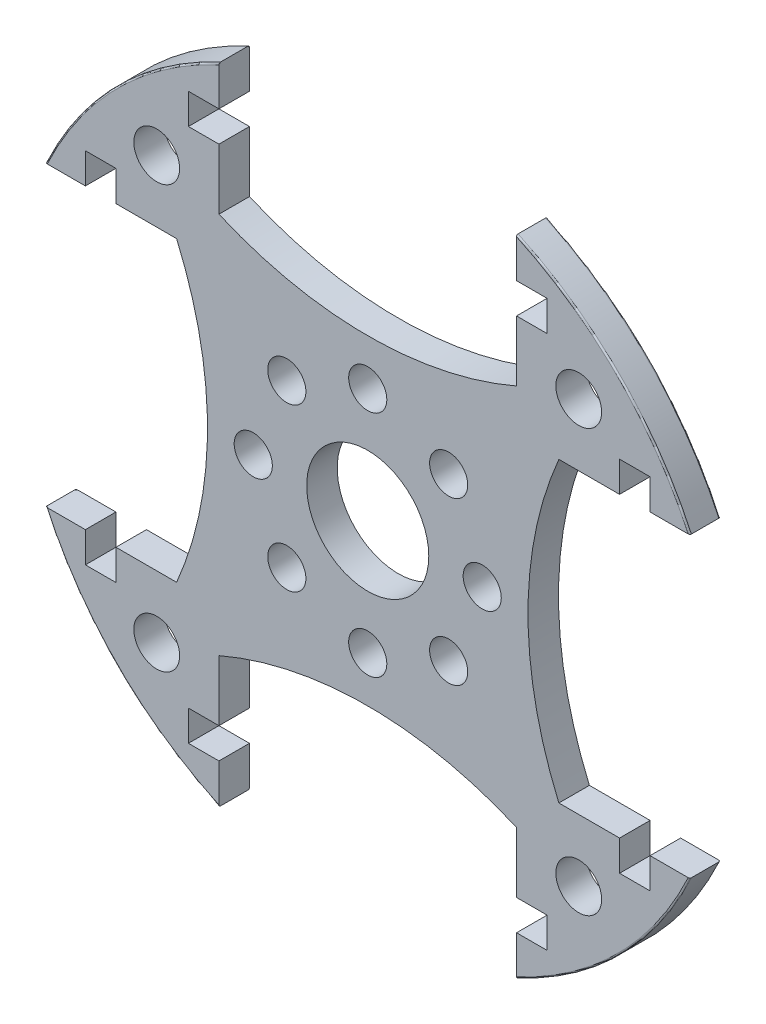
from build123d import *

# Parameters (mm, degrees)
SKETCH_2_R      = 4
SKETCH_2_R_2    = 1.25
SKETCH_2_R_3    = 1.5
EXTRUDE_1_DEPTH = 2
FILLET_1_R      = 0.1


with BuildPart() as part:
    # Эскиз2 → Бобышка-Вытянуть1 (new body)
    with BuildSketch(Plane.XY):
        with BuildLine():
            Line((-9.75, 16.5), (-9.75, 12.523623513))
            ThreePointArc((-9.75, 12.523623513), (0, 10.5), (9.75, 12.523623513))
            Line((9.75, 12.523623513), (9.75, 16.5))
            Line((9.75, 16.5), (11.75, 16.5))
            Line((11.75, 16.5), (11.75, 18.5))
            Line((11.75, 18.5), (9.75, 18.5))
            Line((9.75, 18.5), (9.75, 21.106870919))
            ThreePointArc((9.75, 21.106870919), (16.440232663, 16.440232663), (21.106870919, 9.75))
            Line((21.106870919, 9.75), (18.5, 9.75))
            Line((18.5, 9.75), (18.5, 11.75))
            Line((18.5, 11.75), (16.5, 11.75))
            Line((16.5, 11.75), (16.5, 9.75))
            Line((16.5, 9.75), (12.523623513, 9.75))
            ThreePointArc((12.523623513, 9.75), (10.5, 0), (12.523623513, -9.75))
            Line((12.523623513, -9.75), (16.5, -9.75))
            Line((16.5, -9.75), (16.5, -11.75))
            Line((16.5, -11.75), (18.5, -11.75))
            Line((18.5, -11.75), (18.5, -9.75))
            Line((18.5, -9.75), (21.106870919, -9.75))
            ThreePointArc((21.106870919, -9.75), (16.440232663, -16.440232663), (9.75, -21.106870919))
            Line((9.75, -21.106870919), (9.75, -18.5))
            Line((9.75, -18.5), (11.75, -18.5))
            Line((11.75, -18.5), (11.75, -16.5))
            Line((11.75, -16.5), (9.75, -16.5))
            Line((9.75, -16.5), (9.75, -12.523623513))
            ThreePointArc((9.75, -12.523623513), (0, -10.5), (-9.75, -12.523623513))
            Line((-9.75, -12.523623513), (-9.75, -16.5))
            Line((-9.75, -16.5), (-11.75, -16.5))
            Line((-11.75, -16.5), (-11.75, -18.5))
            Line((-11.75, -18.5), (-9.75, -18.5))
            Line((-9.75, -18.5), (-9.75, -21.106870919))
            ThreePointArc((-9.75, -21.106870919), (-16.440232663, -16.440232663), (-21.106870919, -9.75))
            Line((-21.106870919, -9.75), (-18.5, -9.75))
            Line((-18.5, -9.75), (-18.5, -11.75))
            Line((-18.5, -11.75), (-16.5, -11.75))
            Line((-16.5, -11.75), (-16.5, -9.75))
            Line((-16.5, -9.75), (-12.523623513, -9.75))
            ThreePointArc((-12.523623513, -9.75), (-10.5, 0), (-12.523623513, 9.75))
            Line((-12.523623513, 9.75), (-16.5, 9.75))
            Line((-16.5, 9.75), (-16.5, 11.75))
            Line((-16.5, 11.75), (-18.5, 11.75))
            Line((-18.5, 11.75), (-18.5, 9.75))
            Line((-18.5, 9.75), (-21.106870919, 9.75))
            ThreePointArc((-21.106870919, 9.75), (-16.440232663, 16.440232663), (-9.75, 21.106870919))
            Line((-9.75, 21.106870919), (-9.75, 18.5))
            Line((-9.75, 18.5), (-11.75, 18.5))
            Line((-11.75, 18.5), (-11.75, 16.5))
            Line((-11.75, 16.5), (-9.75, 16.5))
        make_face()
        Circle(SKETCH_2_R, mode=Mode.SUBTRACT)
        with Locations((0, 7.5)):
            Circle(SKETCH_2_R_2, mode=Mode.SUBTRACT)
        with Locations((5.303300859, 5.303300859)):
            Circle(SKETCH_2_R_2, mode=Mode.SUBTRACT)
        with Locations((7.5, 0)):
            Circle(SKETCH_2_R_2, mode=Mode.SUBTRACT)
        with Locations((5.303300859, -5.303300859)):
            Circle(SKETCH_2_R_2, mode=Mode.SUBTRACT)
        with Locations((0, -7.5)):
            Circle(SKETCH_2_R_2, mode=Mode.SUBTRACT)
        with Locations((-5.303300859, -5.303300859)):
            Circle(SKETCH_2_R_2, mode=Mode.SUBTRACT)
        with Locations((-7.5, 0)):
            Circle(SKETCH_2_R_2, mode=Mode.SUBTRACT)
        with Locations((-5.303300859, 5.303300859)):
            Circle(SKETCH_2_R_2, mode=Mode.SUBTRACT)
        with Locations((13.825687912, 13.825687912)):
            Circle(SKETCH_2_R_3, mode=Mode.SUBTRACT)
        with Locations((13.825687912, -13.825687912)):
            Circle(SKETCH_2_R_3, mode=Mode.SUBTRACT)
        with Locations((-13.825687912, -13.825687912)):
            Circle(SKETCH_2_R_3, mode=Mode.SUBTRACT)
        with Locations((-13.825687912, 13.825687912)):
            Circle(SKETCH_2_R_3, mode=Mode.SUBTRACT)
    extrude(amount=EXTRUDE_1_DEPTH)

    # Скругление1
    fillet_1_edges = [part.edges().sort_by_distance(p)[0] for p in [
        (16.440232663, -16.440232663, 2),
        (16.440232663, 16.440232663, 2),
        (16.440232663, -16.440232663, 0),
        (-16.440232663, -16.440232663, 0),
        (-16.440232663, 16.440232663, 0),
        (16.440232663, 16.440232663, 0),
        (-16.440232663, 16.440232663, 2),
        (-16.440232663, -16.440232663, 2),
    ]]
    fillet(fillet_1_edges, radius=FILLET_1_R)


solid = part.part
